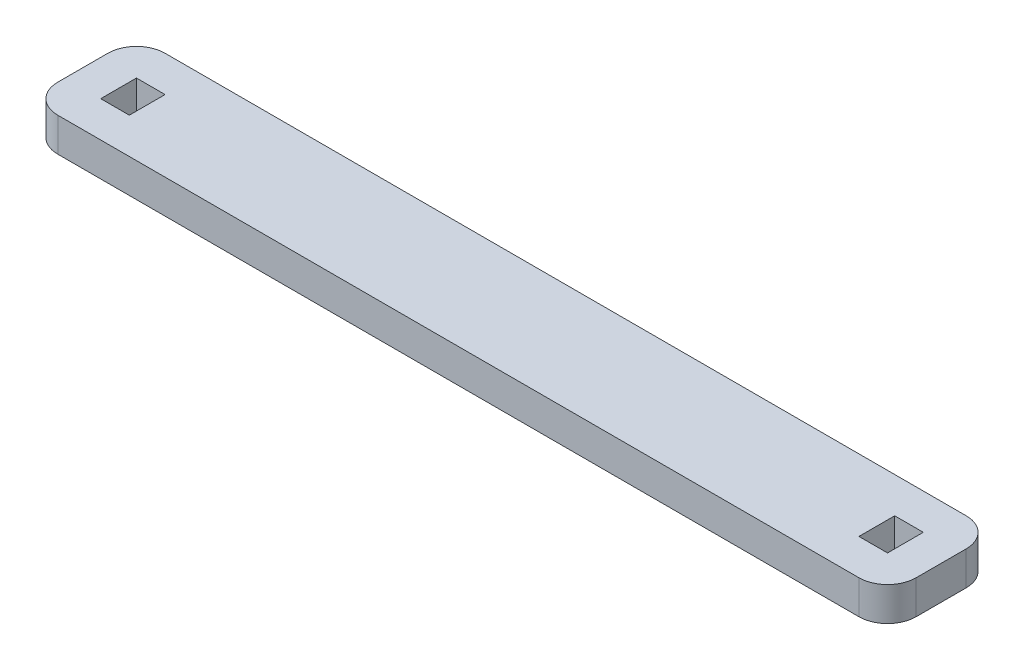
from build123d import *

# Parameters (mm, degrees)
SKETCH1_W           = 76.2
SKETCH1_H           = 9.525
SKETCH1_W_2         = 2.54
SKETCH1_H_2         = 3.175
BOSS_EXTRUDE1_DEPTH = 1.5
FILLET1_R           = 2.54


with BuildPart() as part:
    # Sketch1 → Boss-Extrude1 (new, symmetric)
    with BuildSketch(Plane(origin=(0, 0, 0), x_dir=(1, 0, 0), z_dir=(0, 1, 0))):
        Rectangle(SKETCH1_W, SKETCH1_H)
        with Locations((-33.655, 0)):
            Rectangle(SKETCH1_W_2, SKETCH1_H_2, mode=Mode.SUBTRACT)
        with Locations((33.655, 0)):
            Rectangle(SKETCH1_W_2, SKETCH1_H_2, mode=Mode.SUBTRACT)
    extrude(amount=BOSS_EXTRUDE1_DEPTH, both=True)

    # Fillet1
    fillet1_edges = [part.edges().sort_by_distance(p)[0] for p in [
        (-38.1, 0, -4.7625),
        (38.1, 0, -4.7625),
        (38.1, 0, 4.7625),
        (-38.1, 0, 4.7625),
    ]]
    fillet(fillet1_edges, radius=FILLET1_R)


solid = part.part
